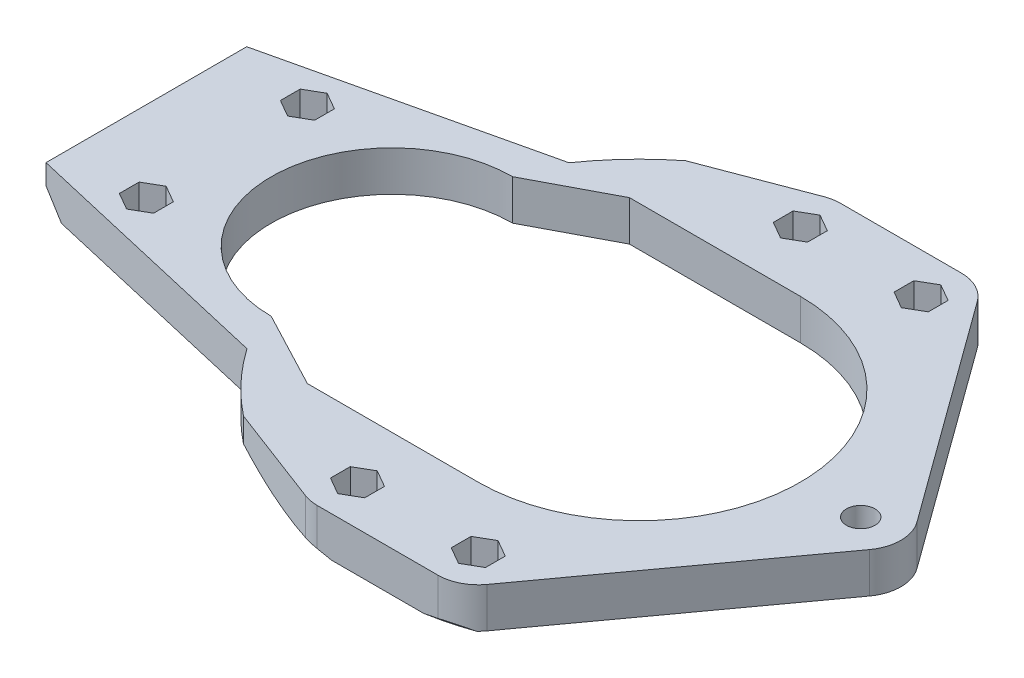
from build123d import *

# Parameters (mm, degrees)
SKETCH1_R                = 70
BOSS_EXTRUDE1_DEPTH      = 10
CUT_EXTRUDE1_DEPTH       = 100.498743711
CUT_EXTRUDE1_DEPTH_BACK  = 100.498743711
CUT_EXTRUDE2_DEPTH       = 100.498743711
CUT_EXTRUDE2_DEPTH_BACK  = 100.498743711
SKETCH3_R                = 2.75
CUT_EXTRUDE3_START       = -10
CUT_EXTRUDE3_DEPTH       = 7
SKETCH5_W                = 80
SKETCH5_H                = 80
BOSS_EXTRUDE2_DEPTH      = 10
CHAMFER1_SIZE            = 4
CUT_EXTRUDE4_DEPTH       = 7
CUT_EXTRUDE5_DEPTH       = 142.215903639
CUT_EXTRUDE5_DEPTH_BACK  = 142.215903639
SKETCH7_R                = 2.75
CUT_EXTRUDE6_DEPTH       = 142.396362897
CUT_EXTRUDE6_DEPTH_BACK  = 142.396362897
CUT_EXTRUDE7_DEPTH       = 142.396362897
CUT_EXTRUDE7_DEPTH_BACK  = 142.396362897
CHAMFER3_SIZE            = 5
CUT_EXTRUDE8_DEPTH       = 142.396362897
CUT_EXTRUDE8_DEPTH_BACK  = 142.396362897
SKETCH10_R               = 2.75
SKETCH11_R               = 3.55
CUT_EXTRUDE9_DEPTH       = 9
CUT_EXTRUDE11_DEPTH      = 142.396362897
CUT_EXTRUDE11_DEPTH_BACK = 142.396362897
SKETCH12_OUTSIDE_W       = 242.084
SKETCH12_OUTSIDE_H       = 189.638


with BuildPart() as part:
    # Sketch1 → Boss-Extrude1 (new body)
    with BuildSketch(Plane(origin=(0, 0, 0), x_dir=(1, 0, 0), z_dir=(0, 1, 0))):
        with Locations(Location((0, 0, 0), (0, 0, 270))):
            Circle(SKETCH1_R)
    extrude(amount=BOSS_EXTRUDE1_DEPTH)

    # Sketch2 → Cut-Extrude1 (cut, two sides: drawn at the far end of the back side and taken through both)
    with BuildSketch(Plane(origin=(0, 10, 0), x_dir=(1, 0, 0), z_dir=(0, 1, 0)).offset(-CUT_EXTRUDE1_DEPTH_BACK)):
        with BuildLine():
            Line((0, -40), (-130.143973447, -40))
            ThreePointArc((-130.143973447, -40), (-170.143973447, 0), (-130.143973447, 40))
            Line((-130.143973447, 40), (0, 40))
            ThreePointArc((0, 40), (40, 0), (0, -40))
        make_face()
    extrude(amount=CUT_EXTRUDE1_DEPTH + CUT_EXTRUDE1_DEPTH_BACK, mode=Mode.SUBTRACT)

    # Sketch3 → Cut-Extrude2 (cut, two sides: drawn at the far end of the back side and taken through both)
    with BuildSketch(Plane(origin=(0, 0, 0), x_dir=(-1, 0, 0), z_dir=(0, -1, 0)).offset(-CUT_EXTRUDE2_DEPTH_BACK)):
        with Locations(Location((15, 55, 0), (0, 0, 90))):
            Circle(SKETCH3_R)
        with Locations(Location((-15, 55, 0), (0, 0, 90))):
            Circle(SKETCH3_R)
        with Locations(Location((-15, -55, 0), (0, 0, 270))):
            Circle(SKETCH3_R)
        with Locations(Location((15, -55, 0), (0, 0, 270))):
            Circle(SKETCH3_R)
    extrude(amount=CUT_EXTRUDE2_DEPTH + CUT_EXTRUDE2_DEPTH_BACK, mode=Mode.SUBTRACT)

    # Sketch4 → Cut-Extrude3 (cut)
    with BuildSketch(Plane.XZ.offset(CUT_EXTRUDE3_START)):
        Polygon((-15, -50.092522712), (-19.25, -52.546261356), (-19.25, -57.453738644), (-15, -59.907477288), (-10.75, -57.453738644), (-10.75, -52.546261356), align=None)
        Polygon((15, -50.092522712), (10.75, -52.546261356), (10.75, -57.453738644), (15, -59.907477288), (19.25, -57.453738644), (19.25, -52.546261356), align=None)
        Polygon((-15, 59.907477288), (-19.25, 57.453738644), (-19.25, 52.546261356), (-15, 50.092522712), (-10.75, 52.546261356), (-10.75, 57.453738644), align=None)
        Polygon((15, 59.907477288), (10.75, 57.453738644), (10.75, 52.546261356), (15, 50.092522712), (19.25, 52.546261356), (19.25, 57.453738644), align=None)
    extrude(amount=CUT_EXTRUDE3_DEPTH, mode=Mode.SUBTRACT)

    # Sketch5 → Boss-Extrude2 (add)
    with BuildSketch(Plane.XZ):
        with Locations((-82.445626465, 0)):
            Rectangle(SKETCH5_W, SKETCH5_H)
    extrude(amount=-BOSS_EXTRUDE2_DEPTH)

    # Chamfer1
    chamfer1_edges = [part.edges().sort_by_distance(p)[0] for p in [
        (70, 0, 0),
    ]]
    chamfer(chamfer1_edges, length=CHAMFER1_SIZE)

    # Sketch6 → Cut-Extrude4 (cut)
    with BuildSketch(Plane(origin=(0, 10, 0), x_dir=(1, 0, 0), z_dir=(0, 1, 0))):
        Polygon((-102.445626465, 24.907477288), (-106.695626465, 22.453738644), (-106.695626465, 17.546261356), (-102.445626465, 15.092522712), (-98.195626465, 17.546261356), (-98.195626465, 22.453738644), align=None)
        Polygon((-102.445626465, -15.092522712), (-106.695626465, -17.546261356), (-106.695626465, -22.453738644), (-102.445626465, -24.907477288), (-98.195626465, -22.453738644), (-98.195626465, -17.546261356), align=None)
    extrude(amount=-CUT_EXTRUDE4_DEPTH, mode=Mode.SUBTRACT)

    # Sketch7 → Cut-Extrude5 (cut, two sides: drawn at the far end of the back side and taken through both)
    with BuildSketch(Plane(origin=(0, 3, 0), x_dir=(1, 0, 0), z_dir=(0, 1, 0)).offset(-CUT_EXTRUDE5_DEPTH_BACK)):
        with Locations(Location((-102.402760328, 20, 0), (0, 0, 270))):
            Circle(SKETCH7_R)
        with Locations(Location((-102.402760328, -20, 0), (0, 0, 270))):
            Circle(SKETCH7_R)
    extrude(amount=CUT_EXTRUDE5_DEPTH + CUT_EXTRUDE5_DEPTH_BACK, mode=Mode.SUBTRACT)

    # Sketch8 → Cut-Extrude6 (cut, two sides: drawn at the far end of the back side and taken through both)
    with BuildSketch(Plane(origin=(0, 10, 0), x_dir=(1, 0, 0), z_dir=(0, 1, 0)).offset(-CUT_EXTRUDE6_DEPTH_BACK)):
        Polygon((-57.445626465, -40), (-132.928087077, -22.5), (-132.928087077, 22.5), (-57.445626465, 40), (-157.567703317, 66.574038668), (-157.567703317, -80.170037604), align=None)
    extrude(amount=CUT_EXTRUDE6_DEPTH + CUT_EXTRUDE6_DEPTH_BACK, mode=Mode.SUBTRACT)

    # Sketch9 → Cut-Extrude7 (cut, two sides: drawn at the far end of the back side and taken through both)
    with BuildSketch(Plane.XZ.offset(-CUT_EXTRUDE7_DEPTH_BACK)):
        with BuildLine():
            Line((-61.450221561, 30), (-42.445626465, 40))
            Line((-42.445626465, 40), (0, 30))
            ThreePointArc((0, 30), (30, 0), (0, -30))
            Line((0, -30), (-42.445626465, -40))
            Line((-42.445626465, -40), (-61.450221561, -30))
            ThreePointArc((-61.450221561, -30), (-91.450221561, 0), (-61.450221561, 30))
        make_face()
    extrude(amount=CUT_EXTRUDE7_DEPTH + CUT_EXTRUDE7_DEPTH_BACK, mode=Mode.SUBTRACT)

    # Chamfer3
    chamfer3_edges = [part.edges().sort_by_distance(p)[0] for p in [
        (-122.445626465, 0, 0),
    ]]
    chamfer(chamfer3_edges, length=CHAMFER3_SIZE)

    # Sketch10 → Cut-Extrude8 (cut, two sides: drawn at the far end of the back side and taken through both)
    with BuildSketch(Plane.XZ.offset(-CUT_EXTRUDE8_DEPTH_BACK)):
        with Locations(Location((55, 0, 0), (0, 0, 270))):
            Circle(SKETCH10_R)
    extrude(amount=CUT_EXTRUDE8_DEPTH + CUT_EXTRUDE8_DEPTH_BACK, mode=Mode.SUBTRACT)

    # Sketch11 → Cut-Extrude9 (cut)
    with BuildSketch(Plane(origin=(0, 10, 0), x_dir=(1, 0, 0), z_dir=(0, 1, 0))):
        with Locations(Location((55, 0, 0), (0, 0, 270))):
            Circle(SKETCH11_R)
    extrude(amount=-CUT_EXTRUDE9_DEPTH, mode=Mode.SUBTRACT)

    # Sketch12 outside → Cut-Extrude11 (cut, two sides: drawn at the far end of the back side and taken through both)
    with BuildSketch(Plane(origin=(0, 10, 0), x_dir=(1, 0, 0), z_dir=(0, 1, 0)).offset(-CUT_EXTRUDE11_DEPTH_BACK)):
        with Locations((-26.223, 0)):
            Rectangle(SKETCH12_OUTSIDE_W, SKETCH12_OUTSIDE_H)
        with BuildLine():
            Line((-122.445626465, 24.93027399), (-18.547305729, 64.349685667))
            ThreePointArc((-18.547305729, 64.349685667), (-16.803211487, 64.836077894), (-15, 65))
            Line((-15, 65), (15, 65))
            ThreePointArc((15, 65), (19.537776451, 63.91114947), (23.087360843, 60.881716977))
            Line((23.087360843, 60.881716977), (63.087360843, 5.881716977))
            ThreePointArc((63.087360843, 5.881716977), (65, 0), (63.087360843, -5.881716977))
            Line((63.087360843, -5.881716977), (23.087360843, -60.881716977))
            ThreePointArc((23.087360843, -60.881716977), (19.537776451, -63.91114947), (15, -65))
            Line((15, -65), (-15, -65))
            ThreePointArc((-15, -65), (-16.803211487, -64.836077894), (-18.547305729, -64.349685667))
            Line((-18.547305729, -64.349685667), (-122.445626465, -24.93027399))
            Line((-122.445626465, -24.93027399), (-122.445626465, 24.93027399))
        make_face(mode=Mode.SUBTRACT)
    extrude(amount=CUT_EXTRUDE11_DEPTH + CUT_EXTRUDE11_DEPTH_BACK, mode=Mode.SUBTRACT)


solid = part.part
